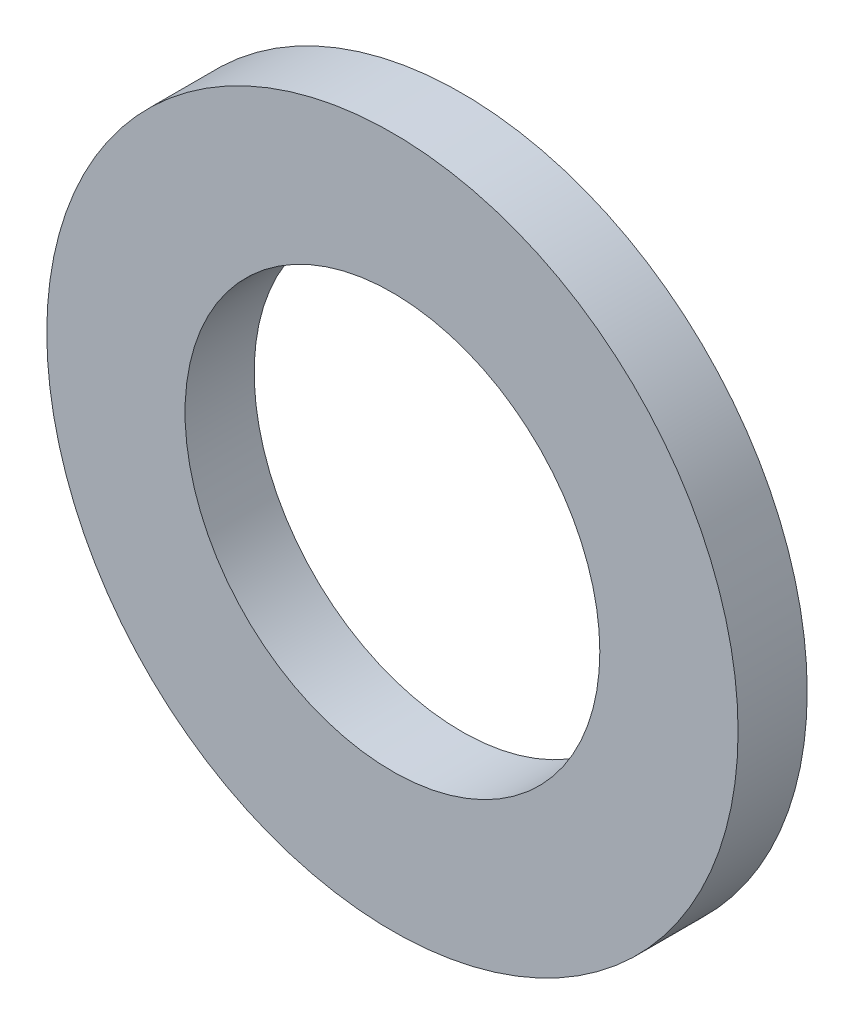
from build123d import *

# Parameters (mm, degrees)
ESQUISSE1_R          = 10
ESQUISSE1_R_2        = 6
BASE_EXTRUSION_DEPTH = 2


with BuildPart() as part:
    # Esquisse1 → Base-Extrusion (new body)
    with BuildSketch(Plane.XY):
        Circle(ESQUISSE1_R)
        Circle(ESQUISSE1_R_2, mode=Mode.SUBTRACT)
    extrude(amount=BASE_EXTRUSION_DEPTH)


solid = part.part
